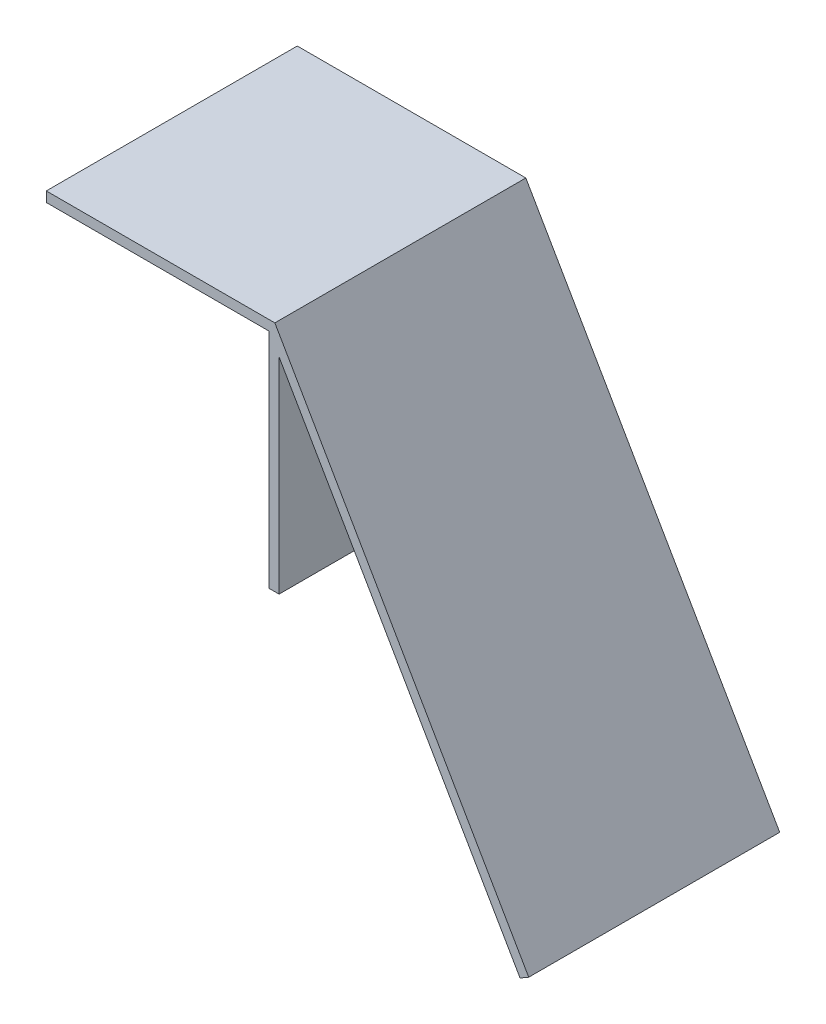
from build123d import *

# Parameters (mm, degrees)
BOSS_EXTRUDE1_DEPTH = 25


with BuildPart() as part:
    # Sketch1 → Boss-Extrude1 (new body)
    with BuildSketch(Plane.XY):
        Polygon((0, 0), (22.766378419, 0), (48.055053554, -43.801270189), (47.18902815, -44.301270189), (23.18902815, -2.732050808), (23.18902815, -23.18902815), (22.18902815, -23.18902815), (22.18902815, -1), (0, -1), align=None)
    extrude(amount=BOSS_EXTRUDE1_DEPTH)


solid = part.part
